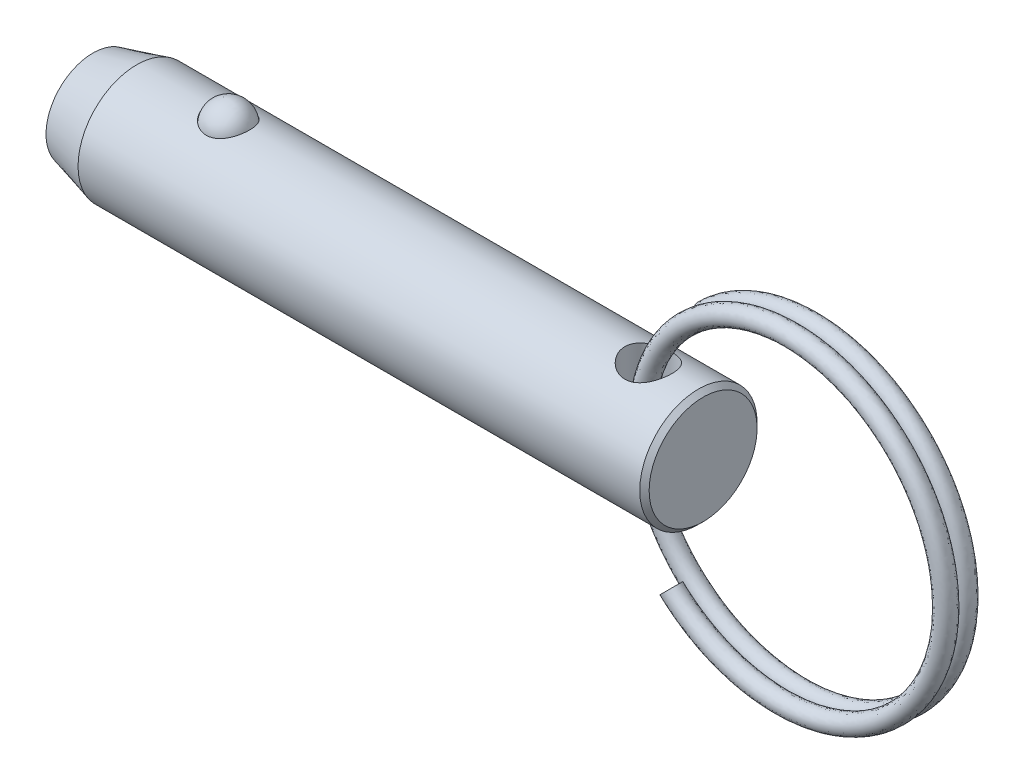
from build123d import *

# Parameters (mm, degrees)
SKETCH4_W          = 1.905
SKETCH4_H          = 9.525
SWEEP1_PITCH       = 1.5494
SWEEP1_HEIGHT      = 1.355725
SWEEP1_RADIUS      = 13.462
SKETCH6_R          = 0.762
SWEEP2_PITCH       = 1.5494
SWEEP2_HEIGHT      = 1.355725
SWEEP2_RADIUS      = 13.462
SWEEP2_START_ANGLE = -180
SKETCH6_2_R        = 0.762


with BuildPart() as part:
    # Sketch1 → Revolve1 (revolve)
    with BuildSketch(Plane.XY, mode=Mode.PRIVATE) as revolve1_sk:
        Polygon((24.765, 4.3815), (24.384, 4.7625), (-21.210221606, 4.7625), (-24.765, 3.81), (-24.765, 0), (24.765, 0), align=None)
    revolve(revolve1_sk.sketch.rotate(Axis((24.765, 0, 0), (1, 0, 0)), 90), axis=Axis((24.765, 0, 0), (1, 0, 0)))

    # Sketch2 → Cut-Revolve1 (revolve, cut)
    with BuildSketch(Plane.XY):
        with BuildLine():
            Line((-11.974387711, 4.28625), (-15.568487711, 4.28625))
            ThreePointArc((-15.568487711, 4.28625), (-13.771437711, 6.0833), (-11.974387711, 4.28625))
        make_face()
    revolve(axis=Axis((-11.974387711, 4.28625, 0), (1, 0, 0)), mode=Mode.SUBTRACT)

    # Sketch4 → Cut-Revolve2 (revolve, cut)
    with BuildSketch(Plane.XY, mode=Mode.PRIVATE) as cut_revolve2_sk:
        with Locations((21.2725, 0)):
            Rectangle(SKETCH4_W, SKETCH4_H)
    revolve(cut_revolve2_sk.sketch.rotate(Axis((20.32, -4.7625, 0), (0, 1, 0)), 90), axis=Axis((20.32, -4.7625, 0), (0, 1, 0)), mode=Mode.SUBTRACT)


with BuildPart() as body_2:
    # Sketch3 → Revolve2 (revolve)
    with BuildSketch(Plane.XY):
        with BuildLine():
            Line((-11.999787711, 4.28625), (-15.543087711, 4.28625))
            ThreePointArc((-15.543087711, 4.28625), (-13.771437711, 6.0579), (-11.999787711, 4.28625))
        make_face()
    revolve(axis=Axis((-11.999787711, 4.28625, 0), (1, 0, 0)))


with BuildPart() as body_3:
    # Sweep1: sweep along a helix
    with BuildLine() as sweep1_path:
        Helix(SWEEP1_PITCH, SWEEP1_HEIGHT, SWEEP1_RADIUS, center=(32.524445847, 0, 0), direction=(0, 0, -1), lefthand=True)
    # Sketch6 → Sweep1 (sweep)
    with BuildSketch(Plane(origin=(114.003847968, 0, 0), x_dir=(0, 0, -1), z_dir=(0, 1, 0))):
        with Locations((0, 94.179402121)):
            Circle(SKETCH6_R)
    sweep(path=sweep1_path.line, is_frenet=True)

    # Sweep2: sweep along a helix
    with BuildLine() as sweep2_path:
        add(Helix(SWEEP2_PITCH, SWEEP2_HEIGHT, SWEEP2_RADIUS, center=(32.524445847, 0, 0), direction=(0, 0, 1), lefthand=True, mode=Mode.PRIVATE).rotate(Axis((32.524445847, 0, 0), (0, 0, 1)), SWEEP2_START_ANGLE))
    # Sketch6<2> → Sweep2 (sweep)
    with BuildSketch(Plane(origin=(114.003847968, 0, 0), x_dir=(0, 0, -1), z_dir=(0, 1, 0))):
        with Locations((0, 94.179402121)):
            Circle(SKETCH6_2_R)
    sweep(path=sweep2_path.line, is_frenet=True)


solid = Compound([part.part, body_2.part, body_3.part])
